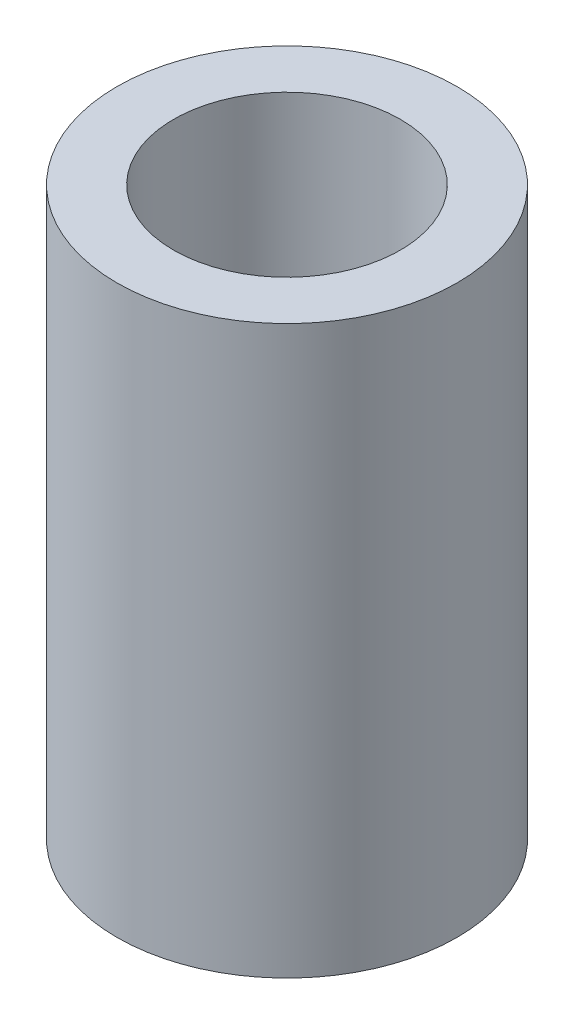
from build123d import *

# Parameters (mm, degrees)
SKETCH1_R           = 4.7625
SKETCH1_R_2         = 3.175
BOSS_EXTRUDE1_DEPTH = 15.875


with BuildPart() as part:
    # Sketch1 → Boss-Extrude1 (new body)
    with BuildSketch(Plane(origin=(0, 0, 0), x_dir=(1, 0, 0), z_dir=(0, 1, 0))):
        with Locations(Location((0, 0, 0), (0, 0, 270))):
            Circle(SKETCH1_R)
        with Locations(Location((0, 0, 0), (0, 0, 270))):
            Circle(SKETCH1_R_2, mode=Mode.SUBTRACT)
    extrude(amount=BOSS_EXTRUDE1_DEPTH)


solid = part.part
